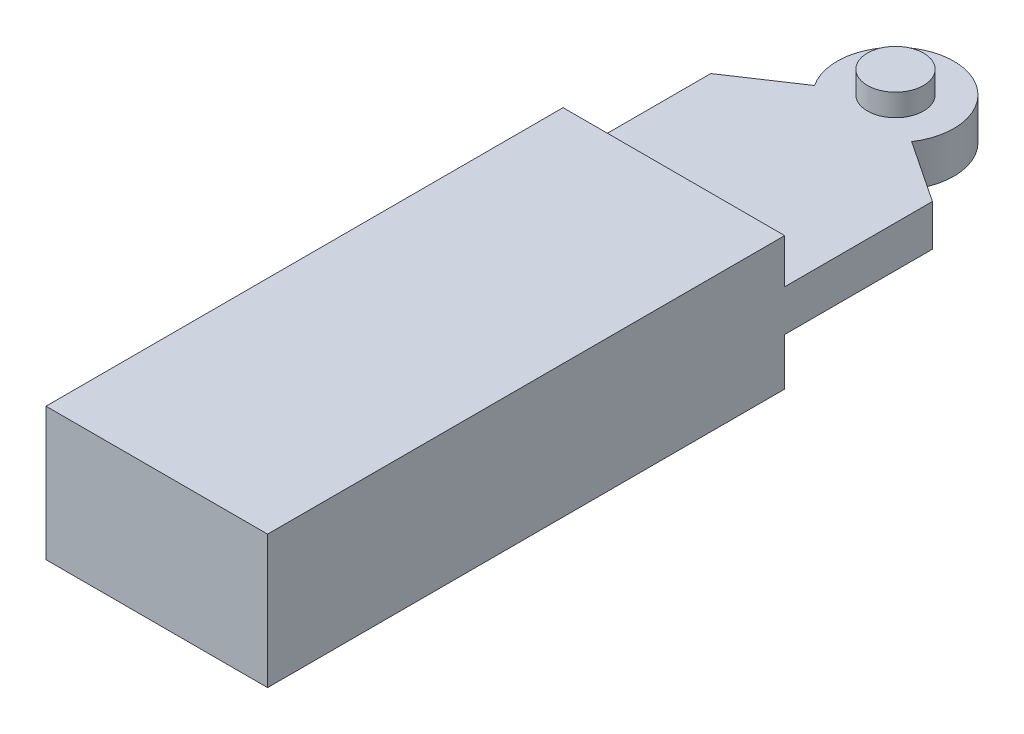
from build123d import *

# Parameters (mm, degrees)
SKETCH1_R                = 39.5
BOSS_EXTRUDE1_DEPTH      = 28
BOSS_EXTRUDE2_DEPTH      = 15
BOSS_EXTRUDE2_DEPTH_BACK = 45
SKETCH2_R                = 19
BOSS_EXTRUDE3_DEPTH      = 28
BOSS_EXTRUDE4_DEPTH      = 30
BOSS_EXTRUDE4_DEPTH_BACK = 60
SKETCH4_W                = 150
SKETCH4_H                = 350


with BuildPart() as part:
    # Sketch1 → Boss-Extrude1 (new body)
    with BuildSketch(Plane(origin=(0, 0, 0), x_dir=(1, 0, 0), z_dir=(0, 1, 0))):
        with Locations(Location((0, 0, 0), (0, 0, 270))):
            Circle(SKETCH1_R)
    extrude(amount=BOSS_EXTRUDE1_DEPTH)

    # Sketch2 → Boss-Extrude2 (add, two sides: drawn at the far end of the back side and taken through both)
    with BuildSketch(Plane(origin=(0, 28, 0), x_dir=(1, 0, 0), z_dir=(0, 1, 0)).offset(-BOSS_EXTRUDE2_DEPTH_BACK)):
        with Locations(Location((0, 0, 0), (0, 0, 270))):
            Circle(SKETCH2_R)
    extrude(amount=BOSS_EXTRUDE2_DEPTH + BOSS_EXTRUDE2_DEPTH_BACK)

    # Sketch3 → Boss-Extrude3 (add)
    with BuildSketch(Plane(origin=(0, 0, 0), x_dir=(1, 0, 0), z_dir=(0, 1, 0))):
        Polygon((0, 0), (-75, -50), (-75, -500), (75, -500), (75, -50), align=None)
    extrude(amount=BOSS_EXTRUDE3_DEPTH)

    # Sketch4 → Boss-Extrude4 (add, two sides: drawn at the far end of the back side and taken through both)
    with BuildSketch(Plane(origin=(0, 28, 0), x_dir=(1, 0, 0), z_dir=(0, 1, 0)).offset(-BOSS_EXTRUDE4_DEPTH_BACK)):
        with Locations((0, -325)):
            Rectangle(SKETCH4_W, SKETCH4_H)
    extrude(amount=BOSS_EXTRUDE4_DEPTH + BOSS_EXTRUDE4_DEPTH_BACK)


solid = part.part
